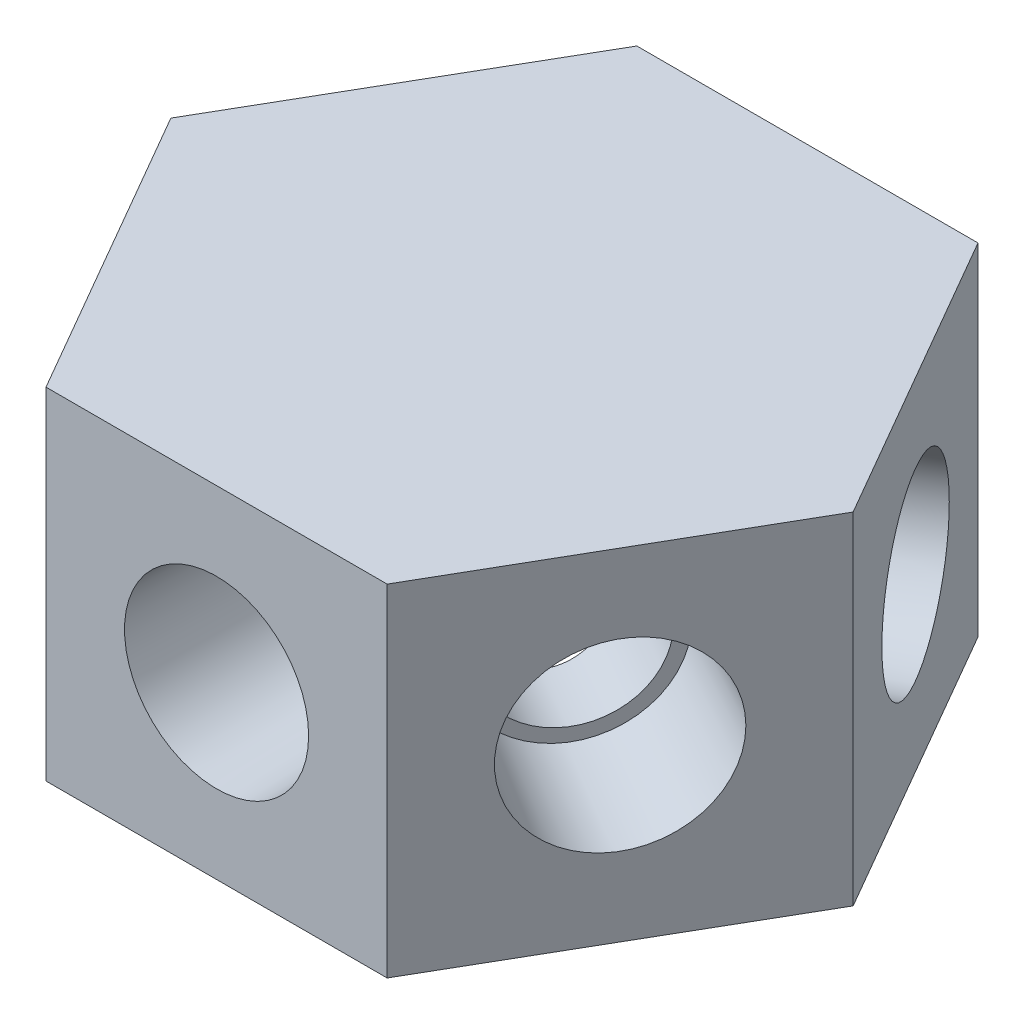
from build123d import *

# Parameters (mm, degrees)
BOSS_EXTRUDE1_DEPTH = 25.4
CIRPATTERN1_COUNT   = 6


with BuildPart() as part:
    # Sketch1 → Boss-Extrude1 (new body)
    with BuildSketch(Plane(origin=(0, 0, 0), x_dir=(1, 0, 0), z_dir=(0, 1, 0))):
        Polygon((25.4, 0), (12.7, 21.997045256), (-12.7, 21.997045256), (-25.4, 0), (-12.7, -21.997045256), (12.7, -21.997045256), align=None)
    extrude(amount=BOSS_EXTRUDE1_DEPTH)

    # Sketch2 → 1/4 NPT Tapped Hole1 (revolve, cut)
    with BuildSketch(Plane(origin=(0, 0, 0), x_dir=(0, 0, -1), z_dir=(1, 0, 0))):
        Polygon((0, 0), (0, 20.360347279), (5.5626, 17.018), (5.5626, 9.906), (6.557984794, 9.906), (6.8545837, 0), align=None)
    revolve(axis=Axis((0, -6.35, 0), (0, 1, 0)), mode=Mode.SUBTRACT)

    # Sketch4 → 1/4 NPT Tapped Hole2 (revolve, cut)
    with BuildSketch(Plane(origin=(0, 12.7, 21.997045256), x_dir=(0, -1, 0), z_dir=(1, 0, 0))):
        Polygon((0, 0), (0, 20.360347279), (5.5626, 17.018), (5.5626, 9.906), (6.557984794, 9.906), (6.8545837, 0), align=None)
    f_1_4_npt_tapped_hole2 = revolve(axis=Axis((0, 12.7, 28.347045256), (0, 0, -1)), mode=Mode.SUBTRACT)

    # CirPattern1: 1/4 NPT Tapped Hole2 ×6 about axis
    cirpattern1_axis = Axis((0, 0, 0), (0, 1, 0))
    for i in range(1, CIRPATTERN1_COUNT):
        add(f_1_4_npt_tapped_hole2.rotate(cirpattern1_axis, i * 360 / CIRPATTERN1_COUNT), mode=Mode.SUBTRACT)


solid = part.part
